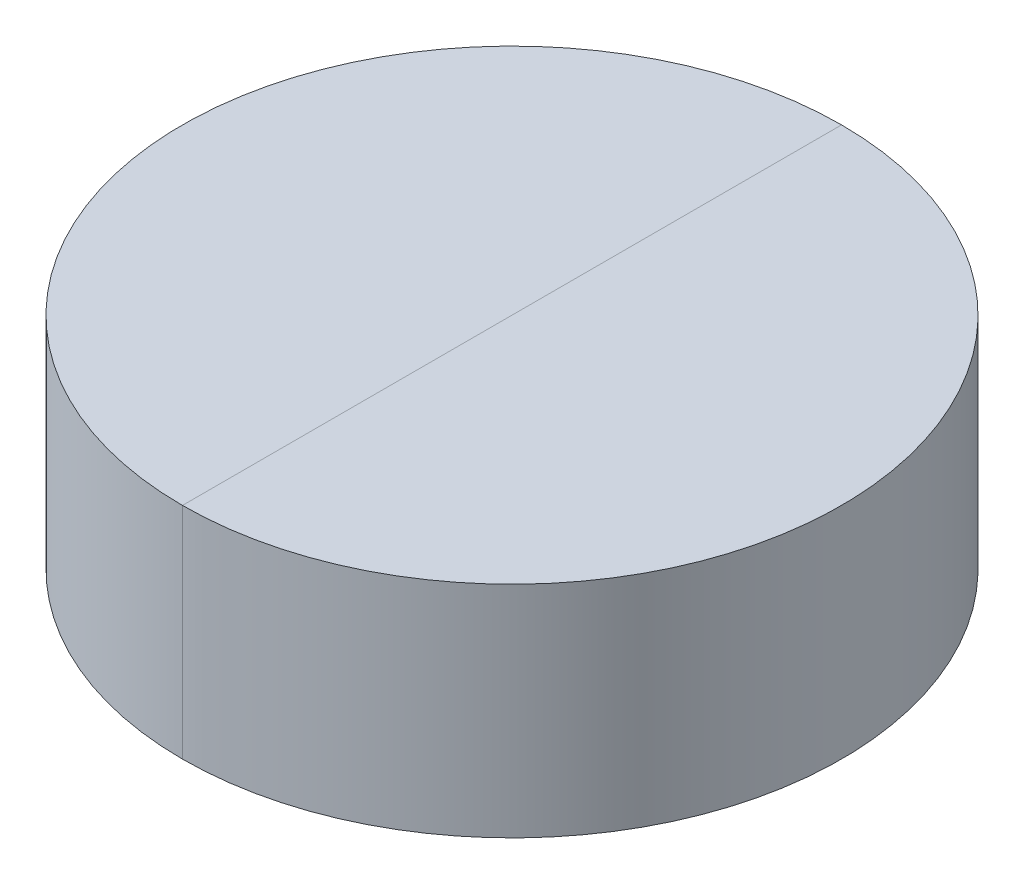
from build123d import *

# Parameters (mm, degrees)
BOSS_EXTRU_1_DEPTH = 2
BOSS_EXTRU_2_DEPTH = 2


with BuildPart() as part:
    # Esquisse1 → Boss.-Extru.1 (new body)
    with BuildSketch(Plane(origin=(0, 0, 0), x_dir=(1, 0, 0), z_dir=(0, 1, 0))):
        with BuildLine():
            Line((0, 3), (0, -3))
            ThreePointArc((0, -3), (-3, 0), (0, 3))
        make_face()
    extrude(amount=BOSS_EXTRU_1_DEPTH)


with BuildPart() as body_2:
    # Esquisse2 → Boss.-Extru.2 (new body)
    with BuildSketch(Plane(origin=(0, 0, 0), x_dir=(1, 0, 0), z_dir=(0, 1, 0))):
        with BuildLine():
            Line((0, -3), (0, 3))
            ThreePointArc((0, 3), (3, 0), (0, -3))
        make_face()
    extrude(amount=BOSS_EXTRU_2_DEPTH)


solid = Compound([part.part, body_2.part])
